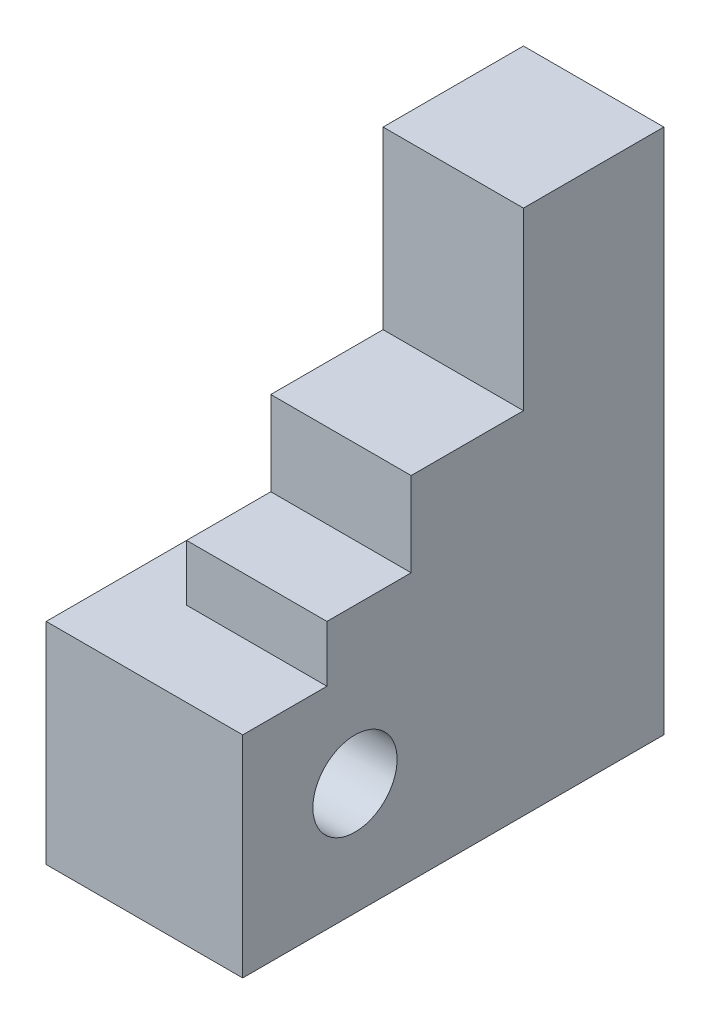
from build123d import *

# Parameters (mm, degrees)
SKETCH1_W           = 28
SKETCH1_H           = 60
BOSS_EXTRUDE1_DEPTH = 30
SKETCH3_W           = 20
SKETCH3_H           = 48
BOSS_EXTRUDE2_DEPTH = 8
SKETCH4_W           = 20
SKETCH4_H           = 36
BOSS_EXTRUDE3_DEPTH = 12
SKETCH5_W           = 20
SKETCH5_H           = 20
BOSS_EXTRUDE4_DEPTH = 25
SKETCH6_R           = 6
CUT_EXTRUDE1_DEPTH  = 35


with BuildPart() as part:
    # Sketch1 → Boss-Extrude1 (new body)
    with BuildSketch(Plane(origin=(0, 0, 0), x_dir=(1, 0, 0), z_dir=(0, 1, 0))):
        Rectangle(SKETCH1_W, SKETCH1_H)
    extrude(amount=BOSS_EXTRUDE1_DEPTH)

    # Sketch3 → Boss-Extrude2 (add)
    with BuildSketch(Plane(origin=(0, 30, 0), x_dir=(1, 0, 0), z_dir=(0, 1, 0))):
        with Locations((4, 6)):
            Rectangle(SKETCH3_W, SKETCH3_H)
    extrude(amount=BOSS_EXTRUDE2_DEPTH)

    # Sketch4 → Boss-Extrude3 (add)
    with BuildSketch(Plane(origin=(0, 38, 0), x_dir=(1, 0, 0), z_dir=(0, 1, 0))):
        with Locations((4, 12)):
            Rectangle(SKETCH4_W, SKETCH4_H)
    extrude(amount=BOSS_EXTRUDE3_DEPTH)

    # Sketch5 → Boss-Extrude4 (add)
    with BuildSketch(Plane(origin=(0, 50, 0), x_dir=(1, 0, 0), z_dir=(0, 1, 0))):
        with Locations((4, 20)):
            Rectangle(SKETCH5_W, SKETCH5_H)
    extrude(amount=BOSS_EXTRUDE4_DEPTH)

    # Sketch6 → Cut-Extrude1 (cut)
    with BuildSketch(Plane.ZY.offset(14)):
        with Locations((14, 16)):
            Circle(SKETCH6_R)
    extrude(amount=-CUT_EXTRUDE1_DEPTH, mode=Mode.SUBTRACT)


solid = part.part
